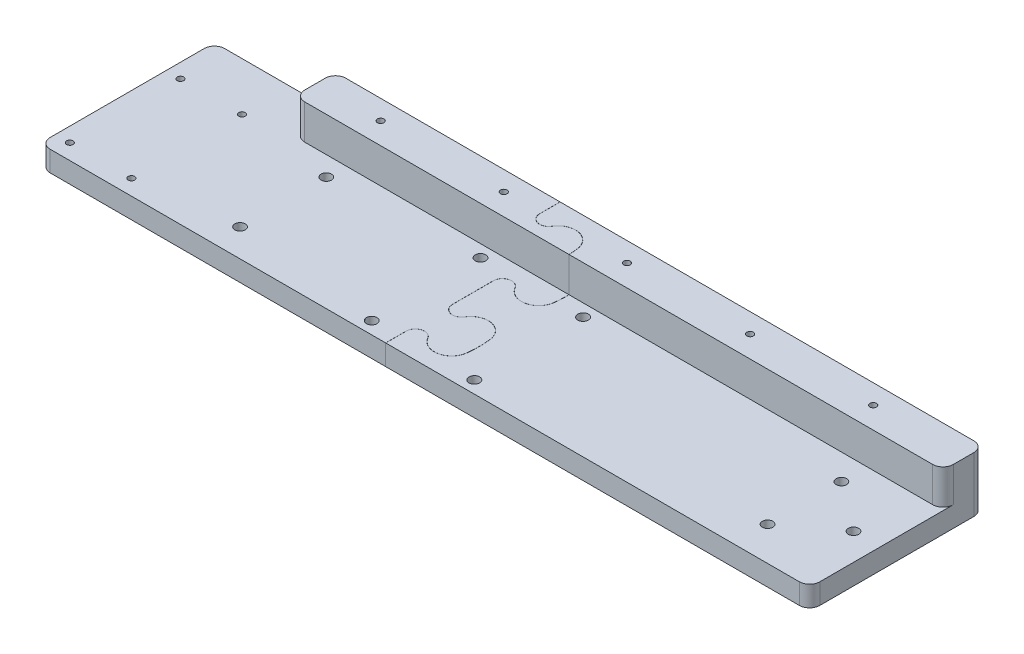
from build123d import *

# Parameters (mm, degrees)
SKETCH1_W                                    = 375
SKETCH1_H                                    = 85
BOSS_EXTRUDE1_DEPTH                          = 6
SKETCH2_W                                    = 316
SKETCH2_H                                    = 20
BOSS_EXTRUDE3_DEPTH                          = 17
MOUNT_HOLES_DEPTH                            = 385.888295483
MOUNT_HOLES_DEPTH_BACK                       = 385.888295483
SKETCH3_R                                    = 1.575
SKETCH3_R_2                                  = 2.55
SKETCH3_R_3                                  = 1.6
SKETCH4_W                                    = 375
SKETCH4_H                                    = 85
SKETCH4_R                                    = 3.575
SKETCH4_R_2                                  = 5.075
BOSS_EXTRUDE4_DEPTH                          = 4
FILLET1_R                                    = 5
WEIRD_CUT_DEPTH                              = 386.459466092
WEIRD_CUT_DEPTH_BACK                         = 386.459466092
IF_YOU_NO_STAY_I_MAKE_U_STAI_BREH_DEPTH      = 385.888295483
IF_YOU_NO_STAY_I_MAKE_U_STAI_BREH_DEPTH_BACK = 385.888295483
SKETCH8_R                                    = 2.575
YUH_DEPTH                                    = 386.459466092
YUH_DEPTH_BACK                               = 4
SKETCH9_R                                    = 5.075


with BuildPart() as part:
    # Sketch1 → Boss-Extrude1 (new body)
    with BuildSketch(Plane(origin=(0, 0, 0), x_dir=(1, 0, 0), z_dir=(0, 1, 0))):
        with Locations((187.5, 42.5)):
            Rectangle(SKETCH1_W, SKETCH1_H)
    extrude(amount=BOSS_EXTRUDE1_DEPTH)

    # Sketch2 → Boss-Extrude3 (add)
    with BuildSketch(Plane(origin=(0, 6, 0), x_dir=(1, 0, 0), z_dir=(0, 1, 0))):
        with Locations((217, 75)):
            Rectangle(SKETCH2_W, SKETCH2_H)
    extrude(amount=BOSS_EXTRUDE3_DEPTH)

    # Sketch3 → Mount Holes (cut, two sides: drawn at the far end of the back side and taken through both)
    with BuildSketch(Plane(origin=(0, 6, 0), x_dir=(1, 0, 0), z_dir=(0, 1, 0)).offset(-MOUNT_HOLES_DEPTH_BACK)):
        with Locations(Location((7, 61.45, 0), (0, 0, 270))):
            Circle(SKETCH3_R)
        with Locations(Location((7, 7.55, 0), (0, 0, 270))):
            Circle(SKETCH3_R)
        with Locations(Location((37, 7.55, 0), (0, 0, 270))):
            Circle(SKETCH3_R)
        with Locations(Location((37, 61.45, 0), (0, 0, 270))):
            Circle(SKETCH3_R)
        with Locations(Location((84, 55.5, 0), (0, 0, 270))):
            Circle(SKETCH3_R_2)
        with Locations(Location((84, 13.5, 0), (0, 0, 270))):
            Circle(SKETCH3_R_2)
        with Locations(Location((338, 52.487064273, 0), (0, 0, 270))):
            Circle(SKETCH3_R_2)
        with Locations(Location((361.89694593, 34.505122955, 0), (0, 0, 270))):
            Circle(SKETCH3_R_2)
        with Locations(Location((338, 16.523181637, 0), (0, 0, 270))):
            Circle(SKETCH3_R_2)
        with Locations(Location((90.5, 75.5, 0), (0, 0, 270))):
            Circle(SKETCH3_R_3)
        with Locations(Location((150.5, 75.5, 0), (0, 0, 270))):
            Circle(SKETCH3_R_3)
        with Locations(Location((210.5, 75.5, 0), (0, 0, 270))):
            Circle(SKETCH3_R_3)
        with Locations(Location((270.5, 75.5, 0), (0, 0, 270))):
            Circle(SKETCH3_R_3)
        with Locations(Location((330.5, 75.5, 0), (0, 0, 270))):
            Circle(SKETCH3_R_3)
    extrude(amount=MOUNT_HOLES_DEPTH + MOUNT_HOLES_DEPTH_BACK, mode=Mode.SUBTRACT)

    # Sketch4 → Boss-Extrude4 (add)
    with BuildSketch(Plane.XZ):
        with Locations((187.5, -42.5)):
            Rectangle(SKETCH4_W, SKETCH4_H)
        with Locations(Location((7, -7.55, 0), (0, 0, 270))):
            Circle(SKETCH4_R, mode=Mode.SUBTRACT)
        with Locations(Location((37, -7.55, 0), (0, 0, 270))):
            Circle(SKETCH4_R, mode=Mode.SUBTRACT)
        with Locations(Location((84, -13.5, 0), (0, 0, 270))):
            Circle(SKETCH4_R_2, mode=Mode.SUBTRACT)
        with Locations(Location((84, -55.5, 0), (0, 0, 270))):
            Circle(SKETCH4_R_2, mode=Mode.SUBTRACT)
        with Locations(Location((37, -61.45, 0), (0, 0, 270))):
            Circle(SKETCH4_R, mode=Mode.SUBTRACT)
        with Locations(Location((7, -61.45, 0), (0, 0, 270))):
            Circle(SKETCH4_R, mode=Mode.SUBTRACT)
        with Locations(Location((90.5, -75.5, 0), (0, 0, 270))):
            Circle(SKETCH4_R, mode=Mode.SUBTRACT)
        with Locations(Location((150.5, -75.5, 0), (0, 0, 270))):
            Circle(SKETCH4_R, mode=Mode.SUBTRACT)
        with Locations(Location((210.5, -75.5, 0), (0, 0, 270))):
            Circle(SKETCH4_R, mode=Mode.SUBTRACT)
        with Locations(Location((270.5, -75.5, 0), (0, 0, 270))):
            Circle(SKETCH4_R, mode=Mode.SUBTRACT)
        with Locations(Location((330.5, -75.5, 0), (0, 0, 270))):
            Circle(SKETCH4_R, mode=Mode.SUBTRACT)
        with Locations(Location((338, -52.487064273, 0), (0, 0, 270))):
            Circle(SKETCH4_R_2, mode=Mode.SUBTRACT)
        with Locations(Location((361.89694593, -34.505122955, 0), (0, 0, 270))):
            Circle(SKETCH4_R_2, mode=Mode.SUBTRACT)
        with Locations(Location((338, -16.523181637, 0), (0, 0, 270))):
            Circle(SKETCH4_R_2, mode=Mode.SUBTRACT)
    extrude(amount=BOSS_EXTRUDE4_DEPTH)

    # Fillet1
    fillet1_edges = [part.edges().sort_by_distance(p)[0] for p in [
        (59, 14.5, -85),
        (59, 14.5, -65),
        (375, 14.5, -65),
        (0, 1, -85),
        (375, 9.5, -85),
        (375, 1, 0),
        (0, 1, 0),
    ]]
    fillet(fillet1_edges, radius=FILLET1_R)

    # Sketch7 → Weird Cut (cut, two sides: drawn at the far end of the back side and taken through both)
    with BuildSketch(Plane.XZ.offset(4).offset(-WEIRD_CUT_DEPTH_BACK)):
        with BuildLine():
            Line((168.429742835, -9.968718608), (168.429742835, 0))
            Line((168.429742835, 0), (168.479742835, 0))
            Line((168.479742835, 0), (168.479742835, -9.968718608))
            ThreePointArc((168.479742835, -9.968718608), (171.739946469, -14.241172009), (176.721509375, -12.224536988))
            ThreePointArc((176.721509375, -12.224536988), (185.762309536, -8.235133349), (192.458717923, -15.502149495))
            ThreePointArc((192.458717923, -15.502149495), (192.814540004, -21.25), (192.458717923, -26.997850505))
            ThreePointArc((192.458717923, -26.997850505), (185.762309536, -34.264866651), (176.721509375, -30.275463012))
            ThreePointArc((176.721509375, -30.275463012), (171.739946469, -28.258827991), (168.479742835, -32.531281392))
            Line((168.479742835, -32.531281392), (168.479742835, -52.468718608))
            ThreePointArc((168.479742835, -52.468718608), (171.739946469, -56.741172009), (176.721509375, -54.724536988))
            ThreePointArc((176.721509375, -54.724536988), (185.762309536, -50.735133349), (192.458717923, -58.002149495))
            ThreePointArc((192.458717923, -58.002149495), (192.814540004, -63.75), (192.458717923, -69.497850505))
            ThreePointArc((192.458717923, -69.497850505), (185.762309536, -76.764866651), (176.721509375, -72.775463012))
            ThreePointArc((176.721509375, -72.775463012), (171.739946469, -70.758827991), (168.479742835, -75.031281392))
            Line((168.479742835, -75.031281392), (168.479742835, -85))
            Line((168.479742835, -85), (168.429742835, -85))
            Line((168.429742835, -85), (168.429742835, -75.031281392))
            ThreePointArc((168.429742835, -75.031281392), (171.726746686, -70.710601797), (176.764540004, -72.75))
            ThreePointArc((176.764540004, -72.75), (185.752114723, -76.715917026), (192.409099686, -69.491683614))
            ThreePointArc((192.409099686, -69.491683614), (192.764540004, -63.75), (192.409099686, -58.008316386))
            ThreePointArc((192.409099686, -58.008316386), (185.752114723, -50.784082974), (176.764540004, -54.75))
            ThreePointArc((176.764540004, -54.75), (171.726746686, -56.789398203), (168.429742835, -52.468718608))
            Line((168.429742835, -52.468718608), (168.429742835, -32.531281392))
            ThreePointArc((168.429742835, -32.531281392), (171.726746686, -28.210601797), (176.764540004, -30.25))
            ThreePointArc((176.764540004, -30.25), (185.752114723, -34.215917026), (192.409099686, -26.991683614))
            ThreePointArc((192.409099686, -26.991683614), (192.764540004, -21.25), (192.409099686, -15.508316386))
            ThreePointArc((192.409099686, -15.508316386), (185.752114723, -8.284082974), (176.764540004, -12.25))
            ThreePointArc((176.764540004, -12.25), (171.726746686, -14.289398203), (168.429742835, -9.968718608))
        make_face()
    extrude(amount=WEIRD_CUT_DEPTH + WEIRD_CUT_DEPTH_BACK, mode=Mode.SUBTRACT)


with BuildPart() as weird_cut_piece_1:
    # of the separate pieces the step leaves, piece 1, a body of its own (weird_cut_pieces)
    add(part.part.solids().sort_by_distance((168.479742835, -4, 0))[0])


with BuildPart() as weird_cut_piece_2:
    # of the separate pieces the step leaves, piece 2, a body of its own (weird_cut_pieces)
    add(part.part.solids().sort_by_distance((5, 6, 0))[0])


with BuildPart() as if_you_no_stay_i_make_u_stai_breh_tool:
    # Sketch8 → If you no stay i make u stai breh (new, two sides: drawn at the far end of the back side and taken through both)
    with BuildSketch(Plane(origin=(0, 6, 0), x_dir=(1, 0, 0), z_dir=(0, 1, 0)).offset(-IF_YOU_NO_STAY_I_MAKE_U_STAI_BREH_DEPTH_BACK)):
        with Locations(Location((205.64714142, 59, 0), (0, 0, 90))):
            Circle(SKETCH8_R)
        with Locations(Location((155.64714142, 59, 0), (0, 0, 90))):
            Circle(SKETCH8_R)
        with Locations(Location((205.64714142, 6, 0), (0, 0, 90))):
            Circle(SKETCH8_R)
        with Locations(Location((155.64714142, 6, 0), (0, 0, 90))):
            Circle(SKETCH8_R)
    extrude(amount=IF_YOU_NO_STAY_I_MAKE_U_STAI_BREH_DEPTH + IF_YOU_NO_STAY_I_MAKE_U_STAI_BREH_DEPTH_BACK)


with BuildPart() as weird_cut_piece_1_1:
    add(weird_cut_piece_1.part)

    # If you no stay i make u stai breh: cut by if_you_no_stay_i_make_u_stai_breh_tool
    add(if_you_no_stay_i_make_u_stai_breh_tool.part, mode=Mode.SUBTRACT)


with BuildPart() as weird_cut_piece_2_1:
    add(weird_cut_piece_2.part)

    # If you no stay i make u stai breh: cut by if_you_no_stay_i_make_u_stai_breh_tool
    add(if_you_no_stay_i_make_u_stai_breh_tool.part, mode=Mode.SUBTRACT)


with BuildPart() as yuh_tool:
    # Sketch9 → yuh (new, two sides: drawn at the far end of the back side and taken through both)
    with BuildSketch(Plane.XZ.offset(4).offset(-YUH_DEPTH_BACK)):
        with Locations(Location((155.64714142, -6, 0), (0, 0, 270))):
            Circle(SKETCH9_R)
        with Locations(Location((205.64714142, -6, 0), (0, 0, 270))):
            Circle(SKETCH9_R)
        with Locations(Location((205.64714142, -59, 0), (0, 0, 270))):
            Circle(SKETCH9_R)
        with Locations(Location((155.64714142, -59, 0), (0, 0, 270))):
            Circle(SKETCH9_R)
    extrude(amount=YUH_DEPTH + YUH_DEPTH_BACK)


with BuildPart() as weird_cut_piece_1_2:
    add(weird_cut_piece_1_1.part)

    # yuh: cut by yuh_tool
    add(yuh_tool.part, mode=Mode.SUBTRACT)


with BuildPart() as weird_cut_piece_2_2:
    add(weird_cut_piece_2_1.part)

    # yuh: cut by yuh_tool
    add(yuh_tool.part, mode=Mode.SUBTRACT)


solid = Compound([weird_cut_piece_1_2.part, weird_cut_piece_2_2.part])
